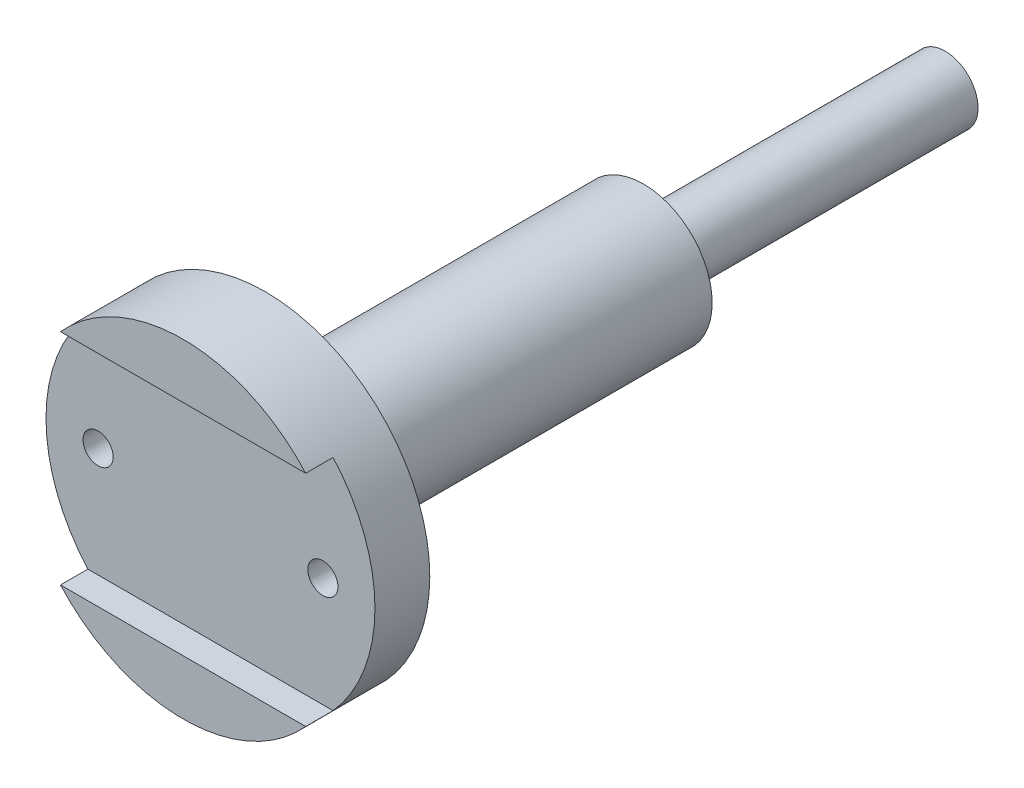
from build123d import *

# Parameters (mm, degrees)
ESQUISSE1_R                                = 30
BOSS_EXTRU_1_DEPTH                         = 15
ESQUISSE2_R                                = 12.5
BOSS_EXTRU_2_DEPTH                         = 69
ESQUISSE4_2_W                              = 230
ESQUISSE4_2_H                              = 40
ENL_V_MAT_EXTRU_1_DEPTH                    = 5
CHAMBRAGE_POUR_VIS_T_TE_HEXAGONALE_2_COUNT = 2
CHAMBRAGE_POUR_VIS_T_TE_HEXAGONALE_2_PITCH = 41
ESQUISSE17_R                               = 6
BOSS_EXTRU_4_DEPTH                         = 55


with BuildPart() as part:
    # Esquisse1 → Boss.-Extru.1 (new body)
    with BuildSketch(Plane.XY):
        Circle(ESQUISSE1_R)
    extrude(amount=BOSS_EXTRU_1_DEPTH)

    # Esquisse2 → Boss.-Extru.2 (add)
    with BuildSketch(Plane(origin=(0, 0, 0), x_dir=(-1, 0, 0), z_dir=(0, 0, -1))):
        Circle(ESQUISSE2_R)
    extrude(amount=BOSS_EXTRU_2_DEPTH)

    # Esquisse4<2> → Enlèv. mat.-Extru.1 (cut)
    with BuildSketch(Plane.XY.offset(15)):
        Rectangle(ESQUISSE4_2_W, ESQUISSE4_2_H)
    extrude(amount=-ENL_V_MAT_EXTRU_1_DEPTH, mode=Mode.SUBTRACT)

    # Esquisse14 → Chambrage pour vis à tête hexagonale M51 (revolve, cut)
    with BuildSketch(Plane.YZ.offset(-20.5)):
        Polygon((0, 0), (0, 15), (2.75, 15), (2.75, 3.605), (2.775, 3.58), (6.12, 3.58), (6.12, 0), align=None)
    chambrage_pour_vis_t_te_hexagonale_m51 = revolve(axis=Axis((-20.5, 0, -6.35), (0, 0, 1)), mode=Mode.SUBTRACT)

    # Chambrage pour vis _ t_te hexagonale 2: Chambrage pour vis à tête hexagonale M51 ×2
    with Locations(*[(i * CHAMBRAGE_POUR_VIS_T_TE_HEXAGONALE_2_PITCH, 0, 0) for i in range(1, CHAMBRAGE_POUR_VIS_T_TE_HEXAGONALE_2_COUNT)]):
        add(chambrage_pour_vis_t_te_hexagonale_m51, mode=Mode.SUBTRACT)

    # Esquisse17 → Boss.-Extru.4 (add)
    with BuildSketch(Plane(origin=(0, 0, -69), x_dir=(-1, 0, 0), z_dir=(0, 0, -1))):
        Circle(ESQUISSE17_R)
    extrude(amount=BOSS_EXTRU_4_DEPTH)


solid = part.part
